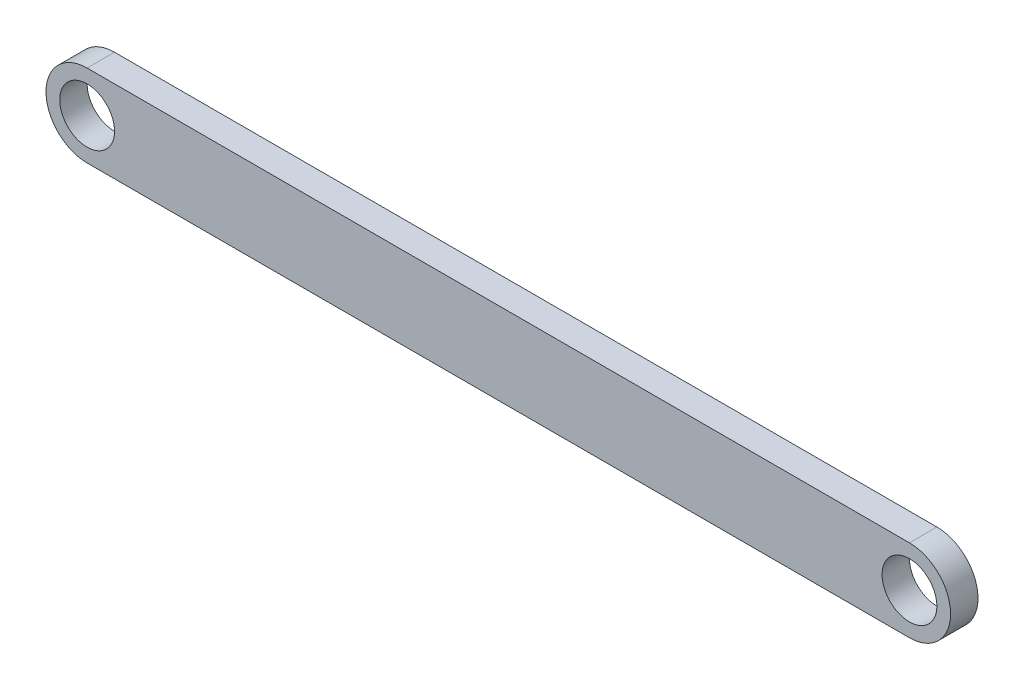
from build123d import *

# Parameters (mm, degrees)
IZIM1_R                     = 5
Y_KSEKLIK_EKSTR_ZYON1_DEPTH = 5


with BuildPart() as part:
    # Çizim1 → Yükseklik-Ekstrüzyon1 (new body)
    with BuildSketch(Plane.XY):
        with BuildLine():
            Line((-43.294417438, 17.364285714), (106.705582562, 17.364285714))
            ThreePointArc((106.705582562, 17.364285714), (114.205582562, 9.864285714), (106.705582562, 2.364285714))
            Line((106.705582562, 2.364285714), (-43.294417438, 2.364285714))
            ThreePointArc((-43.294417438, 2.364285714), (-50.794417438, 9.864285714), (-43.294417438, 17.364285714))
        make_face()
        with Locations((-43.294417438, 9.864285714)):
            Circle(IZIM1_R, mode=Mode.SUBTRACT)
        with Locations((106.705582562, 9.864285714)):
            Circle(IZIM1_R, mode=Mode.SUBTRACT)
    extrude(amount=Y_KSEKLIK_EKSTR_ZYON1_DEPTH)


solid = part.part
